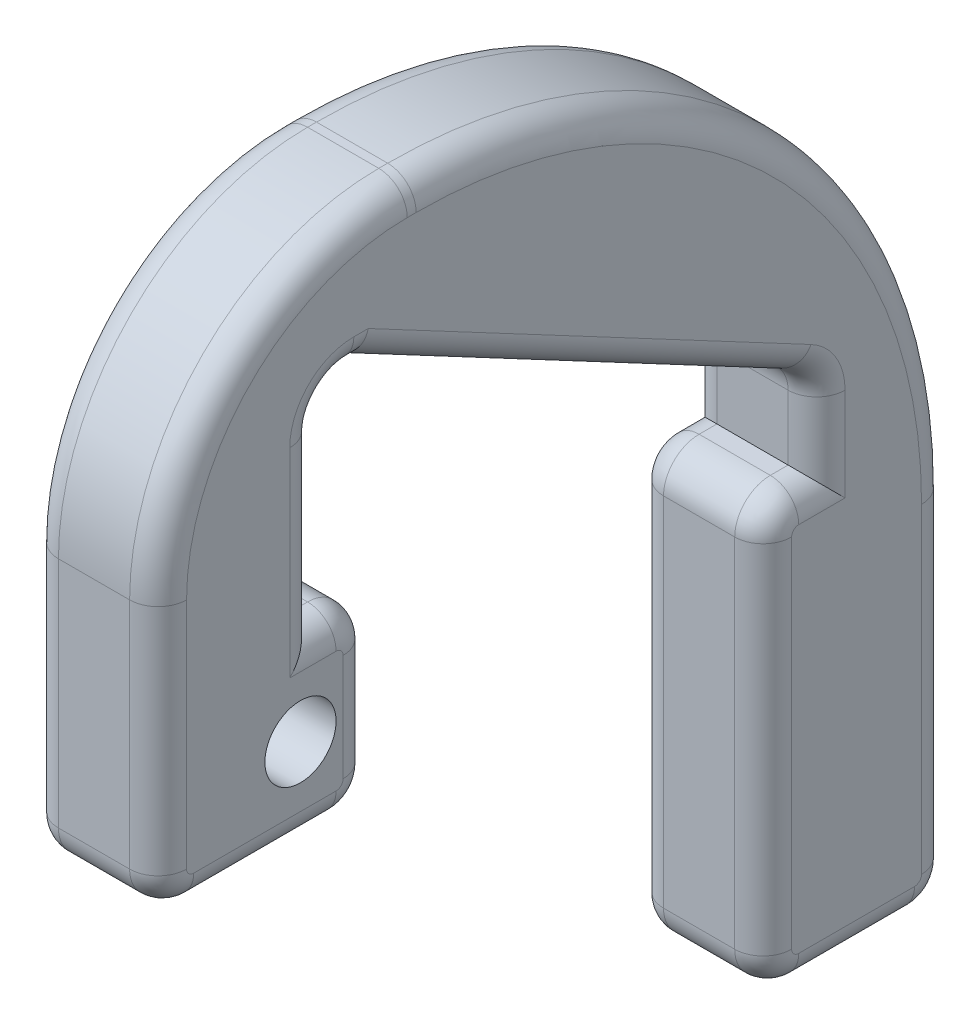
from build123d import *

# Parameters (mm, degrees)
SKETCH1_R           = 1.27
BOSS_EXTRUDE1_DEPTH = 4.572
FILLET4_R           = 1.27
FILLET5_R           = 1.27
FILLET6_R           = 8.89
FILLET7_R           = 19.05
FILLET8_R           = 1.016


with BuildPart() as part:
    # Sketch1 → Boss-Extrude1 (new body)
    with BuildSketch(Plane(origin=(0, 0, 0), x_dir=(0, 0, -1), z_dir=(1, 0, 0))):
        Polygon((-5.715, 23.017636755), (-5.715, 4.539136755), (1.905, 4.539136755), (1.905, 10.889136755), (0, 10.889136755), (0, 18.255136755), (1.531272723, 18.255136755), (17.78, 9.623119465), (17.78, 6.545736755), (15.875, 6.545736755), (15.875, -8.732363245), (22.5425, -8.732363245), (22.5425, 23.017636755), align=None)
        with Locations((-0.635, 7.714136755)):
            Circle(SKETCH1_R, mode=Mode.SUBTRACT)
    extrude(amount=BOSS_EXTRUDE1_DEPTH)

    # Fillet4
    fillet4_edges = [part.edges().sort_by_distance(p)[0] for p in [
        (2.286, 4.539136755, 5.715),
        (2.286, 6.545736755, -15.875),
        (2.286, 10.889136755, -1.905),
        (2.286, 4.539136755, -1.905),
    ]]
    fillet(fillet4_edges, radius=FILLET4_R)

    # Fillet5
    fillet5_edges = [part.edges().sort_by_distance(p)[0] for p in [
        (2.286, -8.732363245, -22.5425),
        (2.286, -8.732363245, -15.875),
        (2.286, 9.623119465, -17.78),
        (2.286, 18.255136755, 0),
    ]]
    fillet(fillet5_edges, radius=FILLET5_R)

    # Fillet6
    fillet6_edges = [part.edges().sort_by_distance(p)[0] for p in [
        (2.286, 23.017636755, 5.715),
    ]]
    fillet(fillet6_edges, radius=FILLET6_R)

    # Fillet7
    fillet7_edges = [part.edges().sort_by_distance(p)[0] for p in [
        (2.286, 23.017636755, -22.5425),
    ]]
    fillet(fillet7_edges, radius=FILLET7_R)

    # Fillet8
    fillet8_edges = [part.edges().sort_by_distance(p)[0] for p in [
        (4.572, 13.937136755, 0),
        (0, 6.545736755, -17.4625),
        (0, 14.118204509, -9.318546725),
        (0, 13.937136755, 0),
        (4.572, 14.118204509, -9.318546725),
        (4.572, 6.545736755, -17.4625),
        (0, -1.093313245, -15.875),
        (4.572, -1.093313245, -15.875),
        (0, 4.539136755, 1.905),
        (0, 10.889136755, -0.3175),
        (0, 7.714136755, -1.905),
        (0, 4.911111143, 5.343025612),
        (0, 4.911111143, -1.533025612),
        (0, 10.517162367, -1.533025612),
        (0, 6.173762367, -16.246974388),
        (4.572, 4.539136755, 1.905),
        (4.572, 7.714136755, -1.905),
        (4.572, 10.889136755, -0.3175),
        (4.572, 4.911111143, 5.343025612),
        (4.572, 4.911111143, -1.533025612),
        (4.572, 10.517162367, -1.533025612),
        (4.572, 6.173762367, -16.246974388),
        (0, 18.255136755, -1.400636361),
        (4.572, 18.255136755, -1.400636361),
        (0, 7.702724325, -17.78),
        (4.572, 7.702724325, -17.78),
        (0, -1.747363245, -22.5425),
        (4.572, -1.747363245, -22.5425),
        (0, -8.732363245, -19.20875),
        (0, -8.360388857, -16.246974388),
        (0, -8.360388857, -22.170525612),
        (4.572, -8.732363245, -19.20875),
        (4.572, -8.360388857, -16.246974388),
        (4.572, -8.360388857, -22.170525612),
        (0, 17.883162367, -0.371974388),
        (4.572, 17.883162367, -0.371974388),
        (0, 9.51400834, -17.598483423),
        (4.572, 9.51400834, -17.598483423),
        (0, 9.968386755, 5.715),
        (4.572, 9.968386755, 5.715),
        (0, 20.413816039, 3.111179285),
        (4.572, 20.413816039, 3.111179285),
        (0, 23.017636755, -3.33375),
        (4.572, 23.017636755, -3.33375),
        (0, 17.438020936, -16.962884182),
        (4.572, 17.438020936, -16.962884182),
    ]]
    fillet(fillet8_edges, radius=FILLET8_R)


solid = part.part
